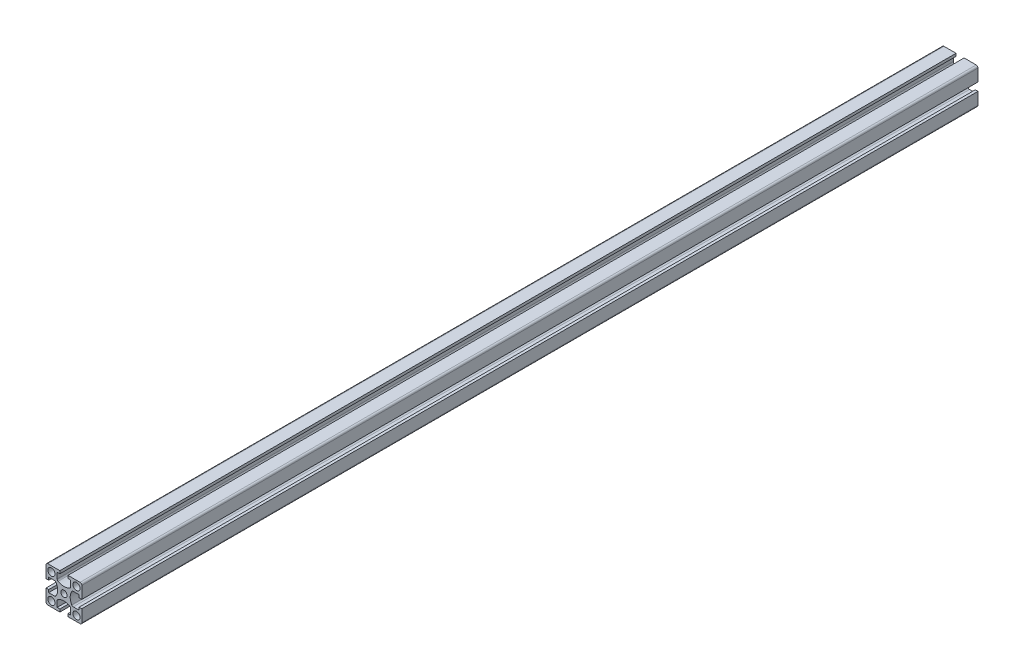
from build123d import *

# Parameters (mm, degrees)
SKETCH1_R           = 2
SKETCH1_R_2         = 1.75
BOSS_EXTRUDE1_DEPTH = 500


with BuildPart() as part:
    # Sketch1 → Boss-Extrude1 (new body)
    with BuildSketch(Plane.XY):
        with BuildLine():
            Line((-10, 9), (-10, 2.25))
            Line((-10, 2.25), (-8.5, 2.25))
            Line((-8.5, 2.25), (-8.5, 3.75))
            Line((-8.5, 3.75), (-5.236860279, 3.75))
            ThreePointArc((-5.236860279, 3.75), (-4.736860279, 3.616025404), (-4.370834875, 3.25))
            ThreePointArc((-4.370834875, 3.25), (-3.5, 0), (-4.370834875, -3.25))
            ThreePointArc((-4.370834875, -3.25), (-4.736860279, -3.616025404), (-5.236860279, -3.75))
            Line((-5.236860279, -3.75), (-8.5, -3.75))
            Line((-8.5, -3.75), (-8.5, -2.25))
            Line((-8.5, -2.25), (-10, -2.25))
            Line((-10, -2.25), (-10, -9))
            ThreePointArc((-10, -9), (-9.707106781, -9.707106781), (-9, -10))
            Line((-9, -10), (-2.25, -10))
            Line((-2.25, -10), (-2.25, -8.5))
            Line((-2.25, -8.5), (-3.75, -8.5))
            Line((-3.75, -8.5), (-3.75, -5.236860279))
            ThreePointArc((-3.75, -5.236860279), (-3.616025404, -4.736860279), (-3.25, -4.370834875))
            ThreePointArc((-3.25, -4.370834875), (0, -3.5), (3.25, -4.370834875))
            ThreePointArc((3.25, -4.370834875), (3.616025404, -4.736860279), (3.75, -5.236860279))
            Line((3.75, -5.236860279), (3.75, -8.5))
            Line((3.75, -8.5), (2.25, -8.5))
            Line((2.25, -8.5), (2.25, -10))
            Line((2.25, -10), (9, -10))
            ThreePointArc((9, -10), (9.707106781, -9.707106781), (10, -9))
            Line((10, -9), (10, -2.25))
            Line((10, -2.25), (8.5, -2.25))
            Line((8.5, -2.25), (8.5, -3.75))
            Line((8.5, -3.75), (5.236860279, -3.75))
            ThreePointArc((5.236860279, -3.75), (4.736860279, -3.616025404), (4.370834875, -3.25))
            ThreePointArc((4.370834875, -3.25), (3.5, 0), (4.370834875, 3.25))
            ThreePointArc((4.370834875, 3.25), (4.736860279, 3.616025404), (5.236860279, 3.75))
            Line((5.236860279, 3.75), (8.5, 3.75))
            Line((8.5, 3.75), (8.5, 2.25))
            Line((8.5, 2.25), (10, 2.25))
            Line((10, 2.25), (10, 9))
            ThreePointArc((10, 9), (9.707106781, 9.707106781), (9, 10))
            Line((9, 10), (2.25, 10))
            Line((2.25, 10), (2.25, 8.5))
            Line((2.25, 8.5), (3.75, 8.5))
            Line((3.75, 8.5), (3.75, 5.236860279))
            ThreePointArc((3.75, 5.236860279), (3.616025404, 4.736860279), (3.25, 4.370834875))
            ThreePointArc((3.25, 4.370834875), (0, 3.5), (-3.25, 4.370834875))
            ThreePointArc((-3.25, 4.370834875), (-3.616025404, 4.736860279), (-3.75, 5.236860279))
            Line((-3.75, 5.236860279), (-3.75, 8.5))
            Line((-3.75, 8.5), (-2.25, 8.5))
            Line((-2.25, 8.5), (-2.25, 10))
            Line((-2.25, 10), (-9, 10))
            ThreePointArc((-9, 10), (-9.707106781, 9.707106781), (-10, 9))
        make_face()
        with Locations((-7, -7)):
            Circle(SKETCH1_R, mode=Mode.SUBTRACT)
        with Locations((7, -7)):
            Circle(SKETCH1_R, mode=Mode.SUBTRACT)
        with Locations((7, 7)):
            Circle(SKETCH1_R, mode=Mode.SUBTRACT)
        Circle(SKETCH1_R_2, mode=Mode.SUBTRACT)
        with Locations((-7, 7)):
            Circle(SKETCH1_R, mode=Mode.SUBTRACT)
    extrude(amount=BOSS_EXTRUDE1_DEPTH)


solid = part.part
